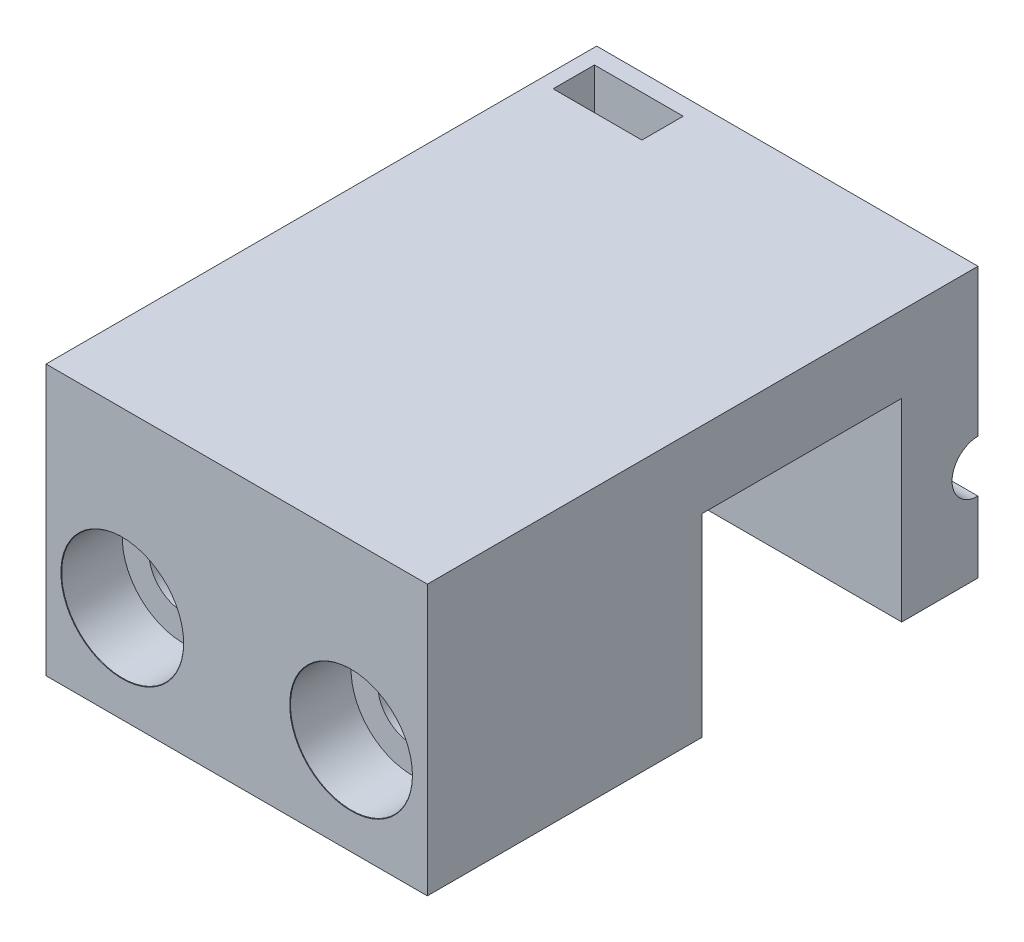
from build123d import *

# Parameters (mm, degrees)
SKETCH10_W                     = 25
SKETCH10_H                     = 12.7
BOSS_EXTRUDE3_DEPTH            = 18
CBORE_FOR_M4_SHCS1_AT_2_COUNT  = 2
CBORE_FOR_M4_SHCS1_AT_2_PITCH  = 15
SKETCH19_W                     = 25
SKETCH19_H                     = 18
BOSS_EXTRUDE6_DEPTH            = 5
SKETCH20_W                     = 25
SKETCH20_H                     = 5
BOSS_EXTRUDE7_DEPTH            = 13.1
SKETCH21_W                     = 25
SKETCH21_H                     = 17.7
BOSS_EXTRUDE8_DEPTH            = 5
CUT_EXTRUDE1_DEPTH             = 33.885141021
CUT_EXTRUDE1_DEPTH_BACK        = 17.18
M3_CLEARANCE_HOLE6_D           = 3.4
M3_CLEARANCE_HOLE6_DEPTH       = 5
M3_CLEARANCE_HOLE6_CSINK_D     = 3.45
M3_CLEARANCE_HOLE6_CSINK_ANGLE = 90
M3_CLEARANCE_HOLE6_TIP         = 1.021463052
SKETCH27_W                     = 5.82
SKETCH27_H                     = 2.71
CUT_EXTRUDE2_DEPTH             = 5.82
SKETCH28_W                     = 5.82
SKETCH28_H                     = 2.71
CUT_EXTRUDE3_DEPTH             = 10.82


with BuildPart() as part:
    # Sketch10 → Boss-Extrude3 (new body)
    with BuildSketch(Plane(origin=(0, 0, 0), x_dir=(-1, 0, 0), z_dir=(0, 0, -1))):
        Rectangle(SKETCH10_W, SKETCH10_H)
    extrude(amount=-BOSS_EXTRUDE3_DEPTH)

    # Sketch17 → CBORE for M4 SHCS1 (revolve, cut)
    with BuildSketch(Plane(origin=(7.5, 0, 18), x_dir=(0, -1, 0), z_dir=(1, 0, 0))):
        Polygon((0, 0), (0, 18), (2.25, 18), (2.25, 4), (4, 4), (4, 0.025), (4.025, 0), align=None)
    cbore_for_m4_shcs1 = revolve(axis=Axis((7.5, 0, 24.35), (0, 0, -1)), mode=Mode.SUBTRACT)

    # CBORE for M4 SHCS1 at 2: CBORE for M4 SHCS1 ×2
    with Locations(*[(-i * CBORE_FOR_M4_SHCS1_AT_2_PITCH, 0, 0) for i in range(1, CBORE_FOR_M4_SHCS1_AT_2_COUNT)]):
        add(cbore_for_m4_shcs1, mode=Mode.SUBTRACT)

    # Sketch19 → Boss-Extrude6 (add)
    with BuildSketch(Plane(origin=(0, 6.35, 0), x_dir=(1, 0, 0), z_dir=(0, 1, 0))):
        with Locations((0, -9)):
            Rectangle(SKETCH19_W, SKETCH19_H)
    extrude(amount=BOSS_EXTRUDE6_DEPTH)

    # Sketch20 → Boss-Extrude7 (add)
    with BuildSketch(Plane(origin=(0, 0, 0), x_dir=(-1, 0, 0), z_dir=(0, 0, -1))):
        with Locations((0, 8.85)):
            Rectangle(SKETCH20_W, SKETCH20_H)
    extrude(amount=BOSS_EXTRUDE7_DEPTH)

    # Sketch21 → Boss-Extrude8 (add)
    with BuildSketch(Plane(origin=(0, 0, -13.1), x_dir=(-1, 0, 0), z_dir=(0, 0, -1))):
        with Locations((0, 2.5)):
            Rectangle(SKETCH21_W, SKETCH21_H)
    extrude(amount=BOSS_EXTRUDE8_DEPTH)

    # Sketch22 → Cut-Extrude1 (cut, two sides: drawn at the far end of the back side and taken through both)
    with BuildSketch(Plane(origin=(12.5, 0, 0), x_dir=(0, 0, -1), z_dir=(1, 0, 0)).offset(-CUT_EXTRUDE1_DEPTH_BACK)):
        with BuildLine():
            Line((104.872716508, 1.7), (18.1, 1.7))
            ThreePointArc((18.1, 1.7), (16.4, 0), (18.1, -1.7))
            Line((18.1, -1.7), (104.872716508, -1.7))
            Line((104.872716508, -1.7), (278.418149524, -1.7))
            Line((278.418149524, -1.7), (278.418149524, 1.7))
            Line((278.418149524, 1.7), (104.872716508, 1.7))
        make_face()
    extrude(amount=CUT_EXTRUDE1_DEPTH + CUT_EXTRUDE1_DEPTH_BACK, mode=Mode.SUBTRACT)

    # M3 Clearance Hole6
    with Locations(Plane(origin=(0, 0, -18.1), x_dir=(-1, 0, 0), z_dir=(0, 0, -1))):
        with Locations((8.59, 4.025), (8.59, -4.025)):
            CounterSinkHole(M3_CLEARANCE_HOLE6_D / 2, M3_CLEARANCE_HOLE6_CSINK_D / 2, depth=M3_CLEARANCE_HOLE6_DEPTH, counter_sink_angle=M3_CLEARANCE_HOLE6_CSINK_ANGLE)
            with Locations((0, 0, -(M3_CLEARANCE_HOLE6_DEPTH + M3_CLEARANCE_HOLE6_TIP / 2))):  # 118° drill point
                Cone(0, M3_CLEARANCE_HOLE6_D / 2, M3_CLEARANCE_HOLE6_TIP, mode=Mode.SUBTRACT)

    # Sketch27 → Cut-Extrude2 (cut)
    with BuildSketch(Plane.XZ.offset(6.35)):
        with Locations((-8.59, -15.6)):
            Rectangle(SKETCH27_W, SKETCH27_H)
    extrude(amount=-CUT_EXTRUDE2_DEPTH, mode=Mode.SUBTRACT)

    # Sketch28 → Cut-Extrude3 (cut)
    with BuildSketch(Plane(origin=(0, 11.35, 11.35), x_dir=(-1, 0, 0), z_dir=(0, 1, 0))):
        with Locations((8.59, -26.95)):
            Rectangle(SKETCH28_W, SKETCH28_H)
    extrude(amount=-CUT_EXTRUDE3_DEPTH, mode=Mode.SUBTRACT)


solid = part.part
